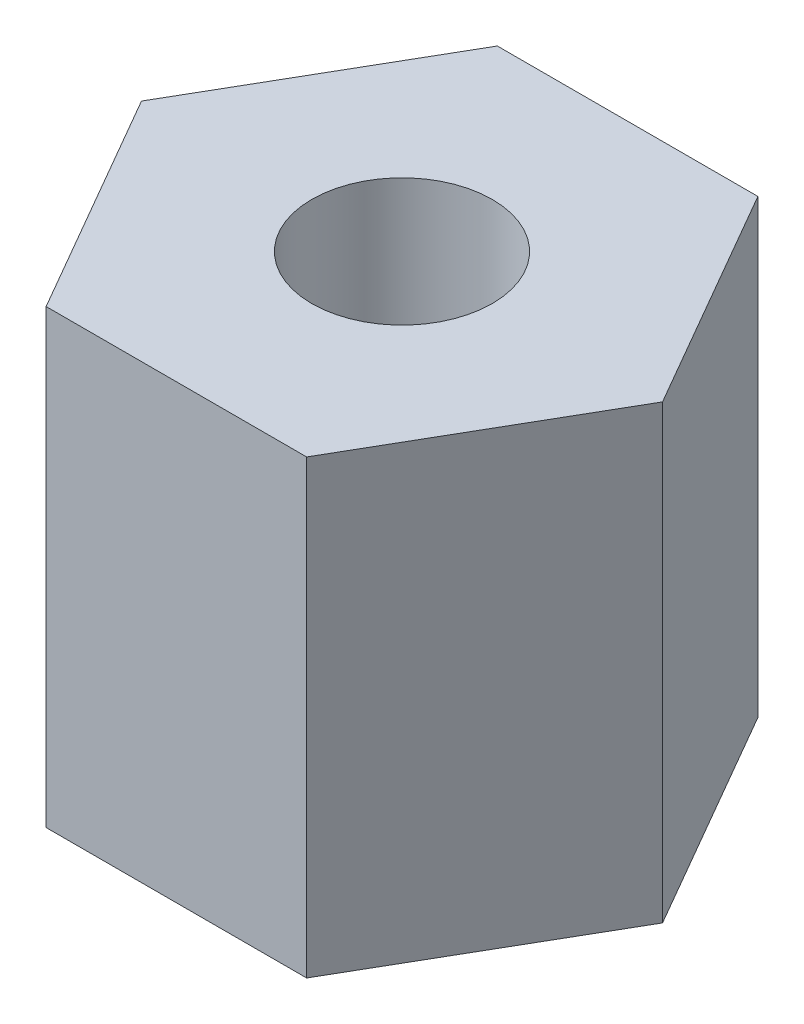
from build123d import *

# Parameters (mm, degrees)
BOSS_EXTRUDE1_DEPTH     = 50
CUT_EXTRUDE1_DEPTH      = 63.915286961
CUT_EXTRUDE1_DEPTH_BACK = 63.915286961
SKETCH3_R               = 10


with BuildPart() as part:
    # Sketch1 → Boss-Extrude1 (new body)
    with BuildSketch(Plane(origin=(0, 0, 0), x_dir=(1, 0, 0), z_dir=(0, 1, 0))):
        Polygon((-14.43375673, 25), (-28.867513459, 0), (-14.43375673, -25), (14.43375673, -25), (28.867513459, 0), (14.43375673, 25), align=None)
    extrude(amount=BOSS_EXTRUDE1_DEPTH)

    # Sketch3 → Cut-Extrude1 (cut, two sides: drawn at the far end of the back side and taken through both)
    with BuildSketch(Plane(origin=(0, 50, 0), x_dir=(1, 0, 0), z_dir=(0, 1, 0)).offset(-CUT_EXTRUDE1_DEPTH_BACK)):
        with Locations(Location((0, 0, 0), (0, 0, 270))):
            Circle(SKETCH3_R)
    extrude(amount=CUT_EXTRUDE1_DEPTH + CUT_EXTRUDE1_DEPTH_BACK, mode=Mode.SUBTRACT)


solid = part.part
